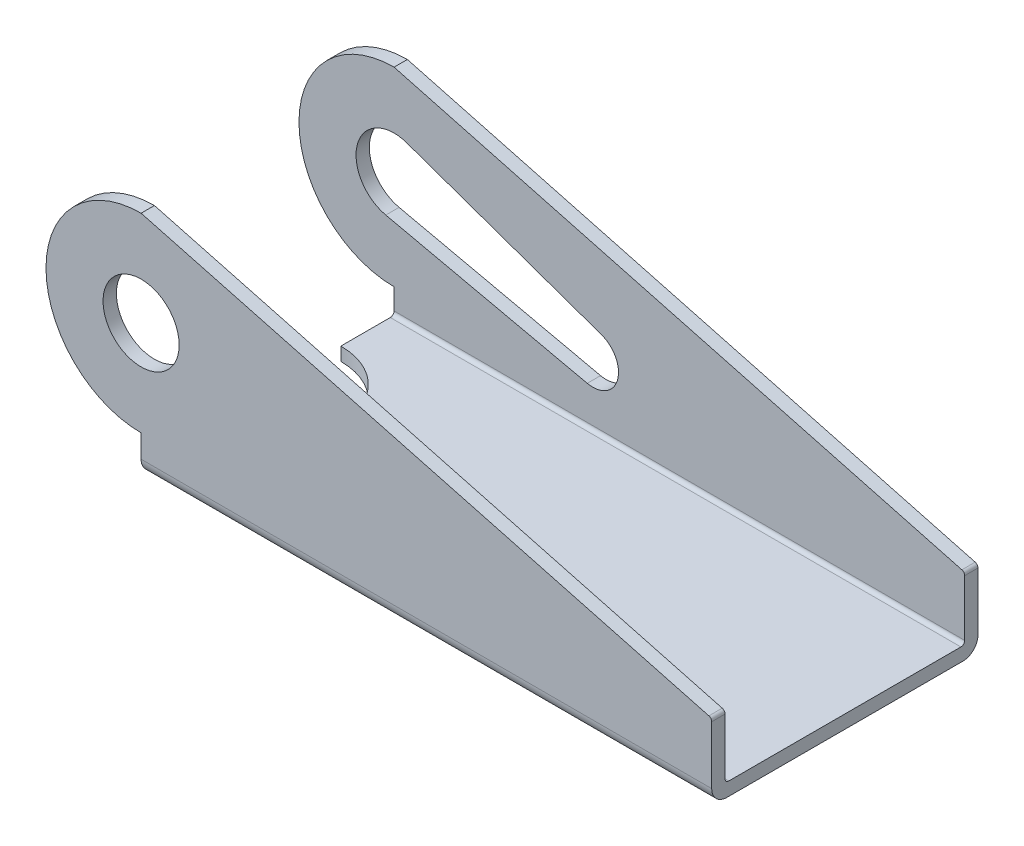
from build123d import *

# Parameters (mm, degrees)
EXTRUDED_BOSS_FRONT_PLANE_WING_DEPTH      = 8.89
EXTRUDED_BOSS_FRONT_PLANE_WING_DEPTH_BACK = 8.89
EXTRUDED_CUT_RIGHT_PLANE_WING_DEPTH       = 31.926520981
EXTRUDED_CUT_RIGHT_PLANE_WING_DEPTH_BACK  = 31.926520981
SKETCH3_W                                 = 16.002
SKETCH3_H                                 = 14.351
F_2X_0_2D_HOLES_D                         = 5.08
F_0_35D_HOLE_D                            = 8.89
F_0_135D_HOLE_D                           = 3.429
F_0_135D_HOLE_DEPTH                       = 0.889
F_0_2D_0_135D_HOLE_CONNECTING_CUT_DEPTH   = 35.098731369
INNER_CONNECTING_FILLET_R                 = 0.254
OUTTER_CONNECTING_FILLET_R                = 1.016


with BuildPart() as part:
    # Sketch2 → Extruded Boss Front Plane Wing (new, two sides: drawn at the far end of the back side and taken through both)
    with BuildSketch(Plane.XY.offset(-EXTRUDED_BOSS_FRONT_PLANE_WING_DEPTH_BACK)):
        with BuildLine():
            Line((-19.05, 0), (19.05, 0))
            Line((19.05, 0), (19.05, 5.08))
            Line((19.05, 5.08), (-19.05, 15.24))
            ThreePointArc((-19.05, 15.24), (-25.4, 8.89), (-19.05, 2.54))
            Line((-19.05, 2.54), (-19.05, 0))
        make_face()
    extrude(amount=EXTRUDED_BOSS_FRONT_PLANE_WING_DEPTH + EXTRUDED_BOSS_FRONT_PLANE_WING_DEPTH_BACK)

    # Sketch3 → Extruded Cut Right Plane Wing (cut, two sides: drawn at the far end of the back side and taken through both)
    with BuildSketch(Plane(origin=(0, 0, 0), x_dir=(0, 0, -1), z_dir=(1, 0, 0)).offset(-EXTRUDED_CUT_RIGHT_PLANE_WING_DEPTH_BACK)):
        with Locations((0, 8.0645)):
            Rectangle(SKETCH3_W, SKETCH3_H)
    extrude(amount=EXTRUDED_CUT_RIGHT_PLANE_WING_DEPTH + EXTRUDED_CUT_RIGHT_PLANE_WING_DEPTH_BACK, mode=Mode.SUBTRACT)

    # 2X 0.2D Holes (through all)
    with Locations(Plane.XY.offset(8.89)):
        with Locations((-19.05, 8.89)):
            Hole(F_2X_0_2D_HOLES_D / 2)

    # 0.35D Hole (through all)
    with Locations(Plane(origin=(0, 0.889, 0), x_dir=(1, 0, 0), z_dir=(0, 1, 0))):
        with Locations((-19.05, 0)):
            Hole(F_0_35D_HOLE_D / 2)

    # 0.135D Hole
    with Locations(Plane.XY.offset(-8.001)):
        with Locations((-5.7785, 5.08)):
            Hole(F_0_135D_HOLE_D / 2, depth=F_0_135D_HOLE_DEPTH)

    # Sketch14 → 0.2D-0.135D Hole Connecting Cut (cut, through all)
    with BuildSketch(Plane.XY.offset(-8.001)):
        Polygon((-19.603662053, 6.411077183), (-6.152221886, 3.406727099), (-5.207730823, 6.696704301), (-18.204416034, 11.285117483), align=None)
    extrude(amount=-F_0_2D_0_135D_HOLE_CONNECTING_CUT_DEPTH, mode=Mode.SUBTRACT)

    # Inner Connecting Fillet
    inner_connecting_fillet_edges = [part.edges().sort_by_distance(p)[0] for p in [
        (19.05, 5.08, 8.4455),
        (0, 0.889, -8.001),
        (0, 0.889, 8.001),
        (19.05, 5.08, -8.4455),
    ]]
    fillet(inner_connecting_fillet_edges, radius=INNER_CONNECTING_FILLET_R)

    # Outter Connecting Fillet
    outter_connecting_fillet_edges = [part.edges().sort_by_distance(p)[0] for p in [
        (0, 0, 8.89),
        (0, 0, -8.89),
    ]]
    fillet(outter_connecting_fillet_edges, radius=OUTTER_CONNECTING_FILLET_R)


solid = part.part
